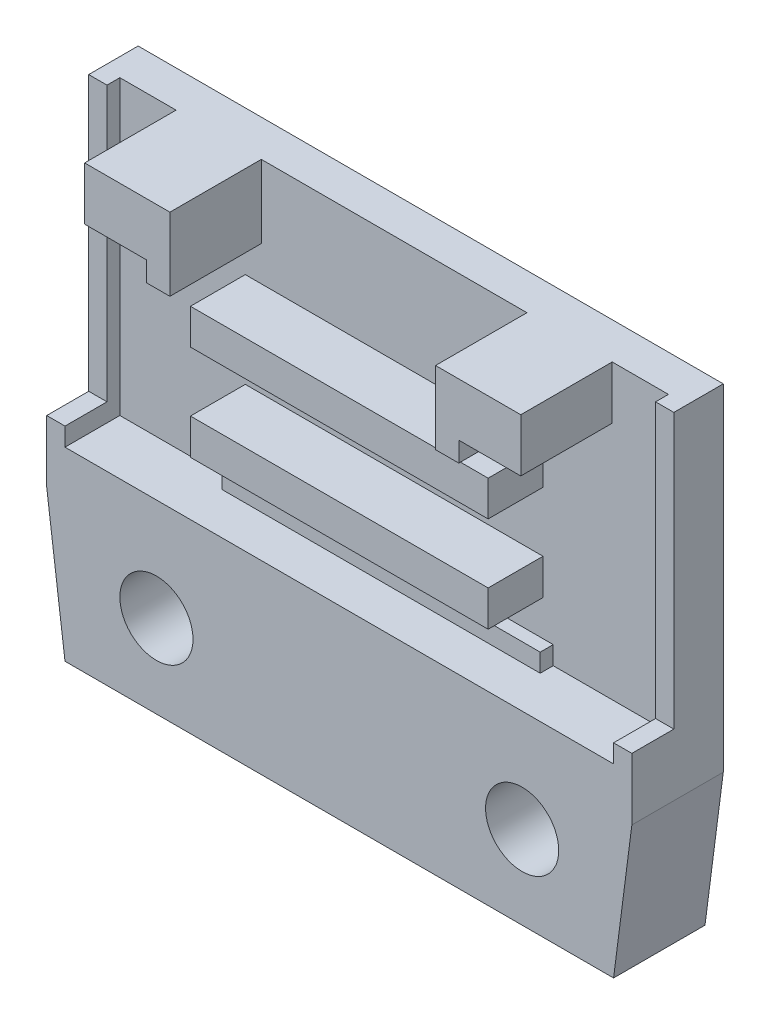
from build123d import *

# Parameters (mm, degrees)
SKETCH_1_W           = 30
SKETCH_1_H           = 15
EXTRUDE_1_DEPTH      = 1
EXTRUDE_2_DEPTH      = 3
EXTRUDE_2_DEPTH_BACK = 2
SKETCH_2_W           = 30
SKETCH_2_H           = 11.139726918
SKETCH_2_R           = 2
SKETCH_3_W           = 6.3
SKETCH_3_H           = 1
CUT_EXTRUDE_1_DEPTH  = 3
EXTRUDE_3_DEPTH      = 1
EXTRUDE_4_DEPTH      = 5
CUT_EXTRUDE_2_REACH  = 31.173
SKETCH_8_W           = 2.28807502
SKETCH_8_H           = 1
EXTRUDE_6_DEPTH      = 5
SKETCH_10_W          = 16.28
SKETCH_10_H          = 1.956604577
SKETCH_10_H_2        = 1.932582498
EXTRUDE_7_DEPTH      = 3
CUT_EXTRUDE_3_DEPTH  = 5


with BuildPart() as part:
    # 草图1 → 凸台-拉伸1 (new, symmetric)
    with BuildSketch(Plane.XY):
        with Locations((15, 7.5)):
            Rectangle(SKETCH_1_W, SKETCH_1_H)
    extrude(amount=EXTRUDE_1_DEPTH, both=True)

    # 草图2 → 凸台-拉伸2 (add, two sides: drawn at the far end of the back side and taken through both)
    with BuildSketch(Plane.XY.offset(1).offset(-EXTRUDE_2_DEPTH_BACK)):
        with Locations((15, -5.569863459)):
            Rectangle(SKETCH_2_W, SKETCH_2_H)
        with Locations((25, -6.6)):
            Circle(SKETCH_2_R, mode=Mode.SUBTRACT)
        with Locations((5, -6.6)):
            Circle(SKETCH_2_R, mode=Mode.SUBTRACT)
    extrude(amount=EXTRUDE_2_DEPTH + EXTRUDE_2_DEPTH_BACK)

    # 草图3 → 切除-拉伸1 (cut)
    with BuildSketch(Plane.XY.offset(4)):
        with Locations((26.85, -0.5)):
            Rectangle(SKETCH_3_W, SKETCH_3_H)
        with Locations((3.15, -0.5)):
            Rectangle(SKETCH_3_W, SKETCH_3_H)
    extrude(amount=-CUT_EXTRUDE_1_DEPTH, mode=Mode.SUBTRACT)

    # 草图4 → 凸台-拉伸3 (add)
    with BuildSketch(Plane(origin=(30, 0, 0), x_dir=(0, 0, -1), z_dir=(1, 0, 0))):
        Polygon((-1.704019465, 0), (-1.704019465, 15), (-1, 15), (1, 15), (1, -3.390976711), (-4, -3.390976711), (-4, 0), align=None)
    extrude_3 = extrude(amount=EXTRUDE_3_DEPTH)

    # 草图5 → 凸台-拉伸4 (add)
    with BuildSketch(Plane.XY.offset(4)):
        Polygon((31, -3.390976711), (30, -11.139726918), (30, -3.390976711), align=None)
    extrude_4 = extrude(amount=-EXTRUDE_4_DEPTH)

    # 镜向1: 凸台-拉伸3, 凸台-拉伸4 across plane
    add(extrude_3.mirror(Plane(origin=(15, 0, 0), x_dir=(0, 0, 1), z_dir=(1, 0, 0))))
    add(extrude_4.mirror(Plane(origin=(15, 0, 0), x_dir=(0, 0, 1), z_dir=(1, 0, 0))))

    # 草图8 → 切除-拉伸2 (cut, up to next)
    with BuildSketch(Plane.ZY.offset(-6.3), mode=Mode.PRIVATE) as cut_extrude_2_sk1:
        with Locations((2.85596249, -0.5)):
            Rectangle(SKETCH_8_W, SKETCH_8_H)
    cut_extrude_2_tool1 = extrude(cut_extrude_2_sk1.sketch, amount=-CUT_EXTRUDE_2_REACH, mode=Mode.PRIVATE) & part.part
    add(cut_extrude_2_tool1.solids().sort_by_distance((6.3, -0.5, 2.855962))[0], mode=Mode.SUBTRACT)

    # 草图9 → 凸台-拉伸6 (add)
    with BuildSketch(Plane.XY.offset(1)):
        Polygon((6.147776054, 15), (3.073888027, 15), (3.073888027, 11.936980184), (6.147776054, 11.936980184), (6.246340003, 11.936980184), (6.246340003, 11.013255946), (7.737344454, 11.013255946), (7.737344454, 15), align=None)
        Polygon((23.852223946, 15), (22.262655546, 15), (22.262655546, 11.013255946), (23.753659997, 11.013255946), (23.753659997, 11.936980184), (23.852223946, 11.936980184), (26.926111973, 11.936980184), (26.926111973, 15), align=None)
    extrude(amount=EXTRUDE_6_DEPTH)

    # 草图10 → 凸台-拉伸7 (add)
    with BuildSketch(Plane.XY.offset(1)):
        with Locations((15, 2.926222334)):
            Rectangle(SKETCH_10_W, SKETCH_10_H)
        with Locations((15, 8.136975565)):
            Rectangle(SKETCH_10_W, SKETCH_10_H_2)
    extrude(amount=EXTRUDE_7_DEPTH)

    # 草图11 → 切除-拉伸3 (cut)
    with BuildSketch(Plane.XY.offset(6)):
        Polygon((3.073888027, 11.936980184), (6.246340003, 11.936980184), (6.246340003, 11.013255946), (6.465703182, 11.013255946), (6.465703182, 12.1), (3.073888027, 12.1), align=None)
        Polygon((26.926111973, 11.936980184), (26.926111973, 12.1), (23.534296818, 12.1), (23.534296818, 11.013255946), (23.753659997, 11.013255946), (23.753659997, 11.936980184), align=None)
    extrude(amount=-CUT_EXTRUDE_3_DEPTH, mode=Mode.SUBTRACT)


solid = part.part
